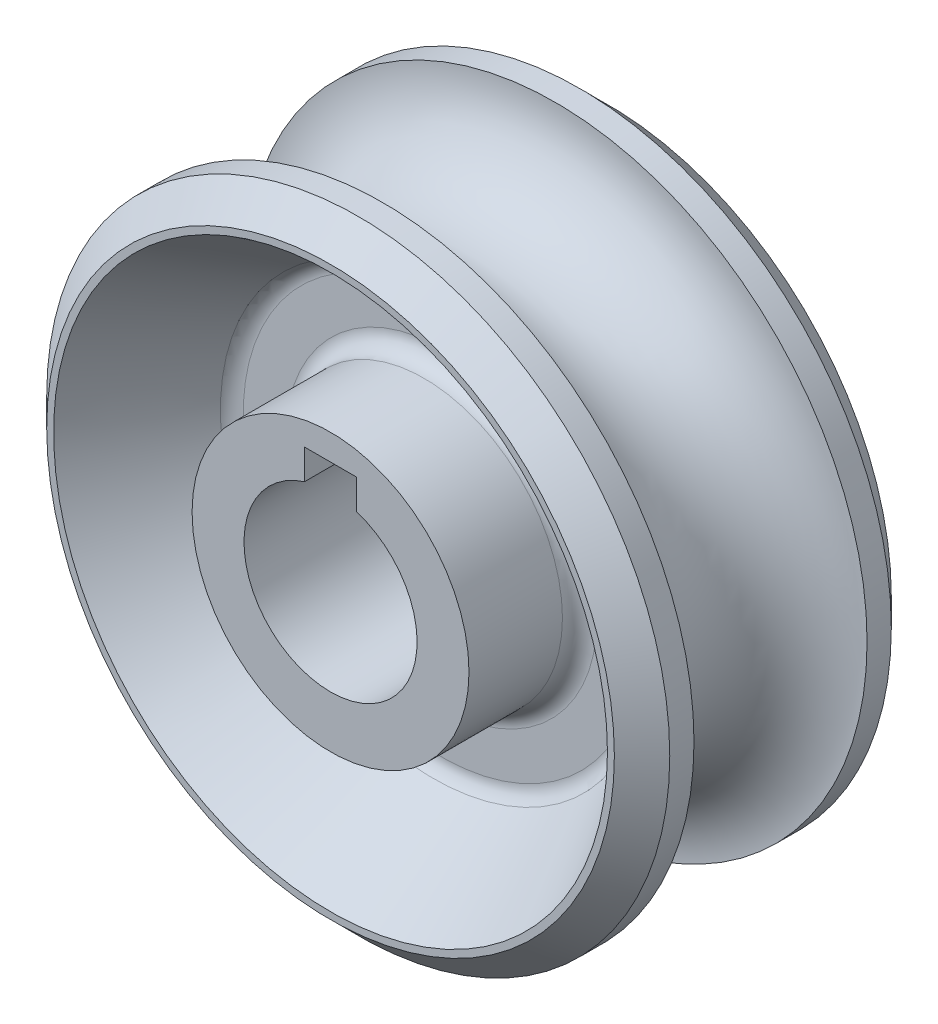
from build123d import *

# Parameters (mm, degrees)
BASE_SKETCH_R      = 28.575
BASE_SKETCH_R_2    = 7.9375
BASE_DEPTH         = 12.7
GROOVE_SKETCH_R    = 7.9375
OUTER_CHAMFER_SIZE = 2.54
INNER_FILLET_R     = 1.5875
KEYWAY_DEPTH       = 43.359783404
KEYWAY_DEPTH_BACK  = 43.359783404
KEYWAY_SKETCH_W    = 4.7752
KEYWAY_SKETCH_H    = 10.3251


with BuildPart() as part:
    # Base Sketch → Base (new, symmetric)
    with BuildSketch(Plane.XY):
        Circle(BASE_SKETCH_R)
        Circle(BASE_SKETCH_R_2, mode=Mode.SUBTRACT)
    extrude(amount=BASE_DEPTH, both=True)

    # Groove Sketch → Outer Revolved Cut (revolve, cut)
    with BuildSketch(Plane(origin=(0, 0, 0), x_dir=(0, 0, -1), z_dir=(1, 0, 0)), mode=Mode.PRIVATE) as outer_revolved_cut_sk:
        with Locations((0, 28.575)):
            Circle(GROOVE_SKETCH_R)
    revolve(outer_revolved_cut_sk.sketch.rotate(Axis((0, 0, 0), (0, 0, -1)), 90), axis=Axis((0, 0, 0), (0, 0, -1)), mode=Mode.SUBTRACT)

    # Sketch3 → Inner Revolved Cut (revolve, cut)
    with BuildSketch(Plane(origin=(0, 0, 0), x_dir=(0, 0, -1), z_dir=(1, 0, 0)), mode=Mode.PRIVATE) as inner_revolved_cut_sk:
        Polygon((12.7, 12.7), (2.54, 12.7), (2.54, 19.05), (12.7, 25.4), align=None)
        Polygon((-12.7, 25.4), (-12.7, 12.7), (-2.54, 12.7), (-2.54, 19.05), align=None)
    revolve(inner_revolved_cut_sk.sketch.rotate(Axis((0, 0, 0), (0, 0, -1)), 90), axis=Axis((0, 0, 0), (0, 0, -1)), mode=Mode.SUBTRACT)

    # Outer Chamfer
    outer_chamfer_edges = [part.edges().sort_by_distance(p)[0] for p in [
        (-28.575, 0, -12.7),
        (-28.575, 0, 12.7),
    ]]
    chamfer(outer_chamfer_edges, length=OUTER_CHAMFER_SIZE)

    # Inner Fillet
    inner_fillet_edges = [part.edges().sort_by_distance(p)[0] for p in [
        (-12.7, 0, -2.54),
        (-19.05, 0, -2.54),
        (-19.05, 0, 2.54),
        (-12.7, 0, 2.54),
    ]]
    fillet(inner_fillet_edges, radius=INNER_FILLET_R)

    # Keyway Sketch → Keyway (cut, two sides: drawn at the far end of the back side and taken through both)
    with BuildSketch(Plane.XY.offset(-KEYWAY_DEPTH_BACK)):
        with Locations((0, 5.16255)):
            Rectangle(KEYWAY_SKETCH_W, KEYWAY_SKETCH_H)
    extrude(amount=KEYWAY_DEPTH + KEYWAY_DEPTH_BACK, mode=Mode.SUBTRACT)


solid = part.part
